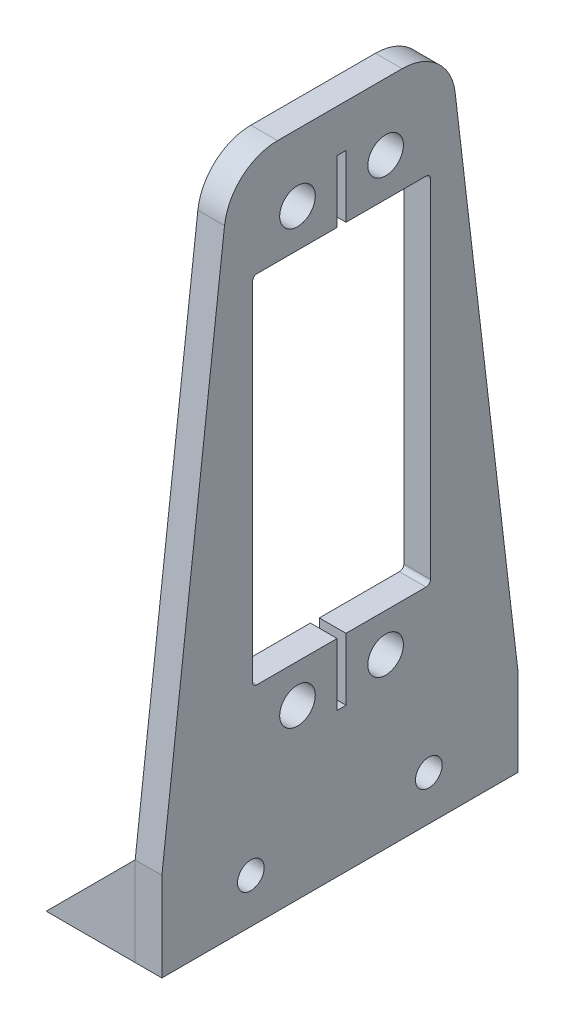
from build123d import *

# Parameters (mm, degrees)
BOSS_EXTRUDE1_DEPTH = 20
BOSS_EXTRUDE2_DEPTH = 3
SKETCH4_R           = 2
CUT_EXTRUDE1_DEPTH  = 3
SKETCH5_R           = 1.5
CUT_EXTRUDE2_DEPTH  = 3


with BuildPart() as part:
    # Sketch1 → Boss-Extrude1 (new, symmetric)
    with BuildSketch(Plane.XY):
        Polygon((20, 0), (20, 10), (10, 0), align=None)
    extrude(amount=BOSS_EXTRUDE1_DEPTH, both=True)


with BuildPart() as body_2:
    # Sketch2 → Boss-Extrude2 (new body)
    with BuildSketch(Plane(origin=(20, 0, 0), x_dir=(0, 0, -1), z_dir=(1, 0, 0))):
        with BuildLine():
            Line((20, 10), (12.958701349, 69.702764704))
            ThreePointArc((12.958701349, 69.702764704), (10.986440253, 73.484227259), (7, 75))
            Line((7, 75), (-7, 75))
            ThreePointArc((-7, 75), (-10.986440253, 73.484227259), (-12.958701349, 69.702764704))
            Line((-12.958701349, 69.702764704), (-20, 10))
            Line((-20, 10), (-20, 0))
            Line((-20, 0), (20, 0))
            Line((20, 0), (20, 10))
        make_face()
    extrude(amount=BOSS_EXTRUDE2_DEPTH)

    # Sketch4 → Cut-Extrude1 (cut)
    with BuildSketch(Plane(origin=(23, 0, 0), x_dir=(0, 0, -1), z_dir=(1, 0, 0))):
        with Locations((5.141504709, 67.5)):
            Circle(SKETCH4_R)
        with Locations((-4.758495291, 67.5)):
            Circle(SKETCH4_R)
        with Locations((5.141504709, 18.9)):
            Circle(SKETCH4_R)
        with Locations((-4.758495291, 18.9)):
            Circle(SKETCH4_R)
        with BuildLine():
            Line((-0.308495291, 23.2), (-0.308495291, 16.2))
            Line((-0.308495291, 16.2), (0.691504709, 16.2))
            Line((0.691504709, 16.2), (0.691504709, 23.2))
            Line((0.691504709, 23.2), (9.441504709, 23.2))
            Line((9.441504709, 23.2), (9.691504709, 23.2))
            ThreePointArc((9.691504709, 23.2), (10.0450581, 23.346446609), (10.191504709, 23.7))
            Line((10.191504709, 23.7), (10.191504709, 62.7))
            ThreePointArc((10.191504709, 62.7), (10.0450581, 63.053553391), (9.691504709, 63.2))
            Line((9.691504709, 63.2), (9.441504709, 63.2))
            Line((9.441504709, 63.2), (0.691504709, 63.2))
            Line((0.691504709, 63.2), (0.691504709, 70.2))
            Line((0.691504709, 70.2), (-0.308495291, 70.2))
            Line((-0.308495291, 70.2), (-0.308495291, 63.2))
            Line((-0.308495291, 63.2), (-9.058495291, 63.2))
            Line((-9.058495291, 63.2), (-9.308495291, 63.2))
            ThreePointArc((-9.308495291, 63.2), (-9.662048682, 63.053553391), (-9.808495291, 62.7))
            Line((-9.808495291, 62.7), (-9.808495291, 23.7))
            ThreePointArc((-9.808495291, 23.7), (-9.662048682, 23.346446609), (-9.308495291, 23.2))
            Line((-9.308495291, 23.2), (-9.058495291, 23.2))
            Line((-9.058495291, 23.2), (-0.308495291, 23.2))
        make_face()
    extrude(amount=-CUT_EXTRUDE1_DEPTH, mode=Mode.SUBTRACT)

    # Sketch5 → Cut-Extrude2 (cut)
    with BuildSketch(Plane(origin=(23, 0, 0), x_dir=(0, 0, -1), z_dir=(1, 0, 0))):
        with Locations((10, 5)):
            Circle(SKETCH5_R)
        with Locations((-10, 5)):
            Circle(SKETCH5_R)
    extrude(amount=-CUT_EXTRUDE2_DEPTH, mode=Mode.SUBTRACT)


solid = Compound([part.part, body_2.part])
